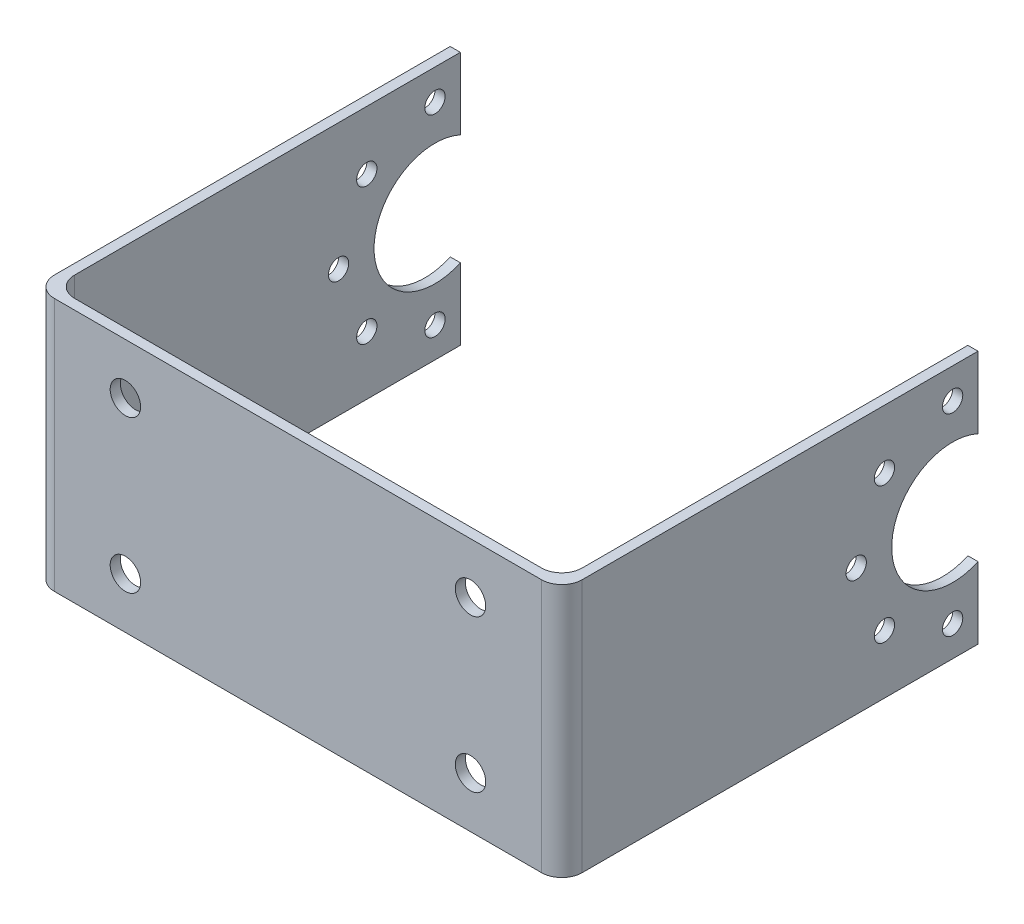
from build123d import *

# Parameters (mm, degrees)
BOSS_EXTRUDE1_DEPTH = 25
SKETCH2_R           = 1
SKETCH2_R_2         = 6
CUT_EXTRUDE1_DEPTH  = 71.492907445
FILLET2_R           = 2
SKETCH3_R           = 1.5
CUT_EXTRUDE2_DEPTH  = 57.358229213


with BuildPart() as part:
    # Sketch1 → Boss-Extrude1 (new body)
    with BuildSketch(Plane(origin=(0, 0, 0), x_dir=(1, 0, 0), z_dir=(0, 1, 0))):
        Polygon((-21.5, 0.5), (28.5, 0.5), (28.5, 40.5), (29.5, 40.5), (29.5, 0.5), (29.5, -0.5), (-22.5, -0.5), (-22.5, 0.5), (-22.5, 40.5), (-21.5, 40.5), align=None)
    extrude(amount=BOSS_EXTRUDE1_DEPTH)

    # Sketch2 → Cut-Extrude1 (cut, through all)
    with BuildSketch(Plane(origin=(29.5, 0, 0), x_dir=(0, 0, -1), z_dir=(1, 0, 0))):
        with Locations((28.5, 12.5)):
            Circle(SKETCH2_R)
        with Locations((38, 12.5)):
            Circle(SKETCH2_R_2)
        with Locations((31.282485579, 19.217514421)):
            Circle(SKETCH2_R)
        with Locations((38, 22)):
            Circle(SKETCH2_R)
        with Locations((38, 3)):
            Circle(SKETCH2_R)
        with Locations((31.282485579, 5.782485579)):
            Circle(SKETCH2_R)
    extrude(amount=-CUT_EXTRUDE1_DEPTH, mode=Mode.SUBTRACT)

    # Fillet2
    fillet2_edges = [part.edges().sort_by_distance(p)[0] for p in [
        (29.5, 12.5, 0.5),
        (-22.5, 12.5, 0.5),
        (-21.5, 12.5, -0.5),
        (28.5, 12.5, -0.5),
    ]]
    fillet(fillet2_edges, radius=FILLET2_R)

    # Sketch3 → Cut-Extrude2 (cut, through all)
    with BuildSketch(Plane.XY.offset(0.5)):
        with Locations((-13.5, 20)):
            Circle(SKETCH3_R)
        with Locations((20.5, 20)):
            Circle(SKETCH3_R)
        with Locations((-13.5, 5)):
            Circle(SKETCH3_R)
        with Locations((20.5, 5)):
            Circle(SKETCH3_R)
    extrude(amount=-CUT_EXTRUDE2_DEPTH, mode=Mode.SUBTRACT)


solid = part.part
